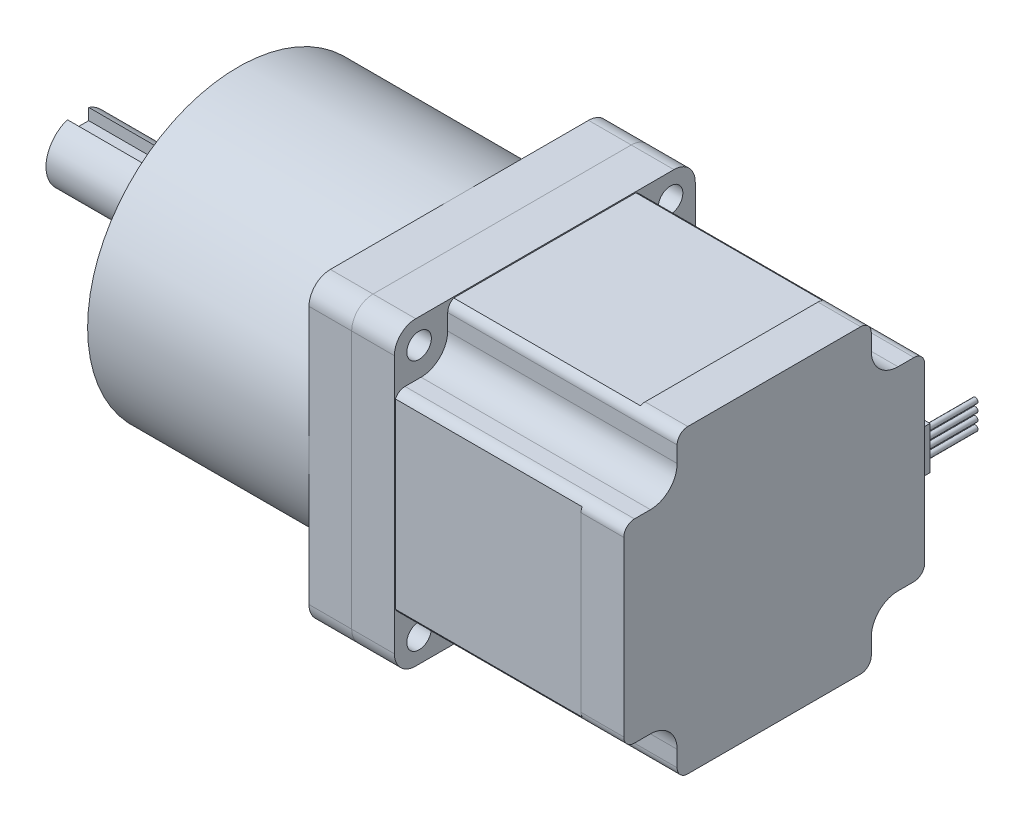
from build123d import *

# Parameters (mm, degrees)
SKETCH_1_W                  = 56.4
SKETCH_1_H                  = 56.4
EXTRUDE_1_DEPTH             = 25.5
SKETCH_7_W                  = 56.4
SKETCH_7_H                  = 56.4
SKETCH_7_W_2                = 56
SKETCH_7_H_2                = 56
CUT_EXTRUDE_1_DEPTH         = 17.5
SKETCH_2_R                  = 19.05
EXTRUDE_2_DEPTH             = 1.6
SKETCH_3_R                  = 3.175
EXTRUDE_3_DEPTH             = 19
SKETCH_10_W                 = 3
SKETCH_10_H                 = 8
EXTRUDE_4_DEPTH             = 3
SKETCH_11_R                 = 0.5
EXTRUDE_5_DEPTH             = 10
SKETCH_12_W                 = 10
SKETCH_12_H                 = 10
CUT_EXTRUDE_2_DEPTH         = 43
FILLET_2_R                  = 5
FILLET_3_R                  = 2
HOLE_WIZARD_4_6_4_6_1_D     = 4.6
HOLE_WIZARD_4_6_4_6_1_DEPTH = 10
HOLE_WIZARD_4_6_4_6_1_TIP   = 1.381979424
FILLET_1_R                  = 4
SKETCH_13_R                 = 2.3
EXTRUDE_6_DEPTH             = 8
SKETCH_14_R                 = 28.2
EXTRUDE_7_DEPTH             = 41.5
SKETCH_15_R                 = 16
EXTRUDE_8_DEPTH             = 2
SKETCH_16_R                 = 6
EXTRUDE_9_DEPTH             = 28
CUT_EXTRUDE_START           = 3.5
CUT_EXTRUDE_4_DEPTH         = 28
HOLE_WIZARD_M5_1_AT_2_COUNT = 2
HOLE_WIZARD_M5_1_AT_2_PITCH = 31.819805153
HOLE_WIZARD_M5_1_AT_3_COUNT = 2
HOLE_WIZARD_M5_1_AT_3_PITCH = 31.819805153
HOLE_WIZARD_M5_1_AT_4_COUNT = 2
HOLE_WIZARD_M5_1_AT_4_PITCH = 45


with BuildPart() as part:
    # 草图1 → 凸台-拉伸1 (new, symmetric)
    with BuildSketch(Plane(origin=(0, 0, 0), x_dir=(0, 0, -1), z_dir=(1, 0, 0))):
        Rectangle(SKETCH_1_W, SKETCH_1_H)
    extrude(amount=EXTRUDE_1_DEPTH, both=True)

    # 草图7 → 切除-拉伸1 (cut, symmetric)
    with BuildSketch(Plane(origin=(0, 0, 0), x_dir=(0, 0, -1), z_dir=(1, 0, 0))):
        Rectangle(SKETCH_7_W, SKETCH_7_H)
        Rectangle(SKETCH_7_W_2, SKETCH_7_H_2, mode=Mode.SUBTRACT)
    extrude(amount=CUT_EXTRUDE_1_DEPTH, both=True, mode=Mode.SUBTRACT)

    # 草图2 → 凸台-拉伸2 (add)
    with BuildSketch(Plane.ZY.offset(25.5)):
        with Locations(Location((0, 0, 0), (0, 0, 180))):
            Circle(SKETCH_2_R)
    extrude(amount=EXTRUDE_2_DEPTH)

    # 草图3 → 凸台-拉伸3 (add)
    with BuildSketch(Plane.ZY.offset(27.1)):
        Circle(SKETCH_3_R)
    extrude(amount=EXTRUDE_3_DEPTH)

    # 草图10 → 凸台-拉伸4 (add)
    with BuildSketch(Plane(origin=(0, 0, -28.2), x_dir=(-1, 0, 0), z_dir=(0, 0, -1))):
        with Locations((-22, 0)):
            Rectangle(SKETCH_10_W, SKETCH_10_H)
    extrude(amount=EXTRUDE_4_DEPTH)

    # 草图11 → 凸台-拉伸5 (add)
    with BuildSketch(Plane(origin=(0, 0, -31.2), x_dir=(-1, 0, 0), z_dir=(0, 0, -1))):
        with Locations(Location((-22, -2.5, 0), (0, 0, 180))):
            Circle(SKETCH_11_R)
        with Locations(Location((-22, -1, 0), (0, 0, 180))):
            Circle(SKETCH_11_R)
        with Locations(Location((-22, 0.5, 0), (0, 0, 180))):
            Circle(SKETCH_11_R)
        with Locations(Location((-22, 2, 0), (0, 0, 180))):
            Circle(SKETCH_11_R)
    extrude(amount=EXTRUDE_5_DEPTH)

    # 草图12 → 切除-拉伸2 (cut)
    with BuildSketch(Plane(origin=(25.5, 0, 0), x_dir=(0, 0, -1), z_dir=(1, 0, 0))):
        with Locations((23.2, -23.2)):
            Rectangle(SKETCH_12_W, SKETCH_12_H)
        with Locations((-23.2, -23.2)):
            Rectangle(SKETCH_12_W, SKETCH_12_H)
        with Locations((-23.2, 23.2)):
            Rectangle(SKETCH_12_W, SKETCH_12_H)
        with Locations((23.2, 23.2)):
            Rectangle(SKETCH_12_W, SKETCH_12_H)
    extrude(amount=-CUT_EXTRUDE_2_DEPTH, mode=Mode.SUBTRACT)

    # 圆角2
    fillet_2_edges = [part.edges().sort_by_distance(p)[0] for p in [
        (4, -18.2, 18.2),
        (4, 18.2, 18.2),
        (4, 18.2, -18.2),
        (4, -18.2, -18.2),
    ]]
    fillet(fillet_2_edges, radius=FILLET_2_R)

    # 圆角3
    fillet_3_edges = [part.edges().sort_by_distance(p)[0] for p in [
        (21.5, 28.2, -18.2),
        (21.5, 28.2, 18.2),
        (21.5, 18.2, 28.2),
        (21.5, -18.2, 28.2),
        (21.5, -28.2, 18.2),
        (21.5, -28.2, -18.2),
        (21.5, -18.2, -28.2),
        (21.5, 18.2, -28.2),
    ]]
    fillet(fillet_3_edges, radius=FILLET_3_R)

    # Ø4.6 (4.6) 直径孔1
    with Locations(Plane.ZY.offset(25.5)):
        with Locations((-23.57, 23.57), (23.57, 23.57), (23.57, -23.57), (-23.57, -23.57)):
            Hole(HOLE_WIZARD_4_6_4_6_1_D / 2, depth=HOLE_WIZARD_4_6_4_6_1_DEPTH)
            with Locations((0, 0, -(HOLE_WIZARD_4_6_4_6_1_DEPTH + HOLE_WIZARD_4_6_4_6_1_TIP / 2))):  # 118° drill point
                Cone(0, HOLE_WIZARD_4_6_4_6_1_D / 2, HOLE_WIZARD_4_6_4_6_1_TIP, mode=Mode.SUBTRACT)

    # 圆角1
    fillet_1_edges = [part.edges().sort_by_distance(p)[0] for p in [
        (-21.5, 28.2, 28.2),
        (-21.5, 28.2, -28.2),
        (-21.5, -28.2, -28.2),
        (-21.5, -28.2, 28.2),
    ]]
    fillet(fillet_1_edges, radius=FILLET_1_R)


with BuildPart() as body_2:
    # 草图13 → 凸台-拉伸6 (new body)
    with BuildSketch(Plane.ZY.offset(25.5)):
        with BuildLine():
            Line((-24.2, -28.2), (24.2, -28.2))
            ThreePointArc((24.2, -28.2), (27.028427125, -27.028427125), (28.2, -24.2))
            Line((28.2, -24.2), (28.2, 24.2))
            ThreePointArc((28.2, 24.2), (27.028427125, 27.028427125), (24.2, 28.2))
            Line((24.2, 28.2), (-24.2, 28.2))
            ThreePointArc((-24.2, 28.2), (-27.028427125, 27.028427125), (-28.2, 24.2))
            Line((-28.2, 24.2), (-28.2, -24.2))
            ThreePointArc((-28.2, -24.2), (-27.028427125, -27.028427125), (-24.2, -28.2))
        make_face()
        with Locations((-23.57, 23.57)):
            Circle(SKETCH_13_R, mode=Mode.SUBTRACT)
        with Locations((23.57, 23.57)):
            Circle(SKETCH_13_R, mode=Mode.SUBTRACT)
        with Locations((-23.57, -23.57)):
            Circle(SKETCH_13_R, mode=Mode.SUBTRACT)
        with Locations((23.57, -23.57)):
            Circle(SKETCH_13_R, mode=Mode.SUBTRACT)
    extrude(amount=EXTRUDE_6_DEPTH)

    # 草图14 → 凸台-拉伸7 (add)
    with BuildSketch(Plane.ZY.offset(33.5)):
        Circle(SKETCH_14_R)
    extrude(amount=EXTRUDE_7_DEPTH)

    # 草图15 → 凸台-拉伸8 (add)
    with BuildSketch(Plane.ZY.offset(75)):
        Circle(SKETCH_15_R)
    extrude(amount=EXTRUDE_8_DEPTH)

    # 草图16 → 凸台-拉伸9 (add)
    with BuildSketch(Plane.ZY.offset(77)):
        Circle(SKETCH_16_R)
    extrude(amount=EXTRUDE_9_DEPTH)

    # 草图17 → 切除-拉伸4 (cut)
    with BuildSketch(Plane(origin=(0, 0, 0), x_dir=(1, 0, 0), z_dir=(0, 1, 0)).offset(CUT_EXTRUDE_START)):
        with BuildLine():
            Line((-105, 2), (-87, 2))
            ThreePointArc((-87, 2), (-85, 0), (-87, -2))
            Line((-87, -2), (-105, -2))
            ThreePointArc((-105, -2), (-107, 0), (-105, 2))
        make_face()
    extrude(amount=CUT_EXTRUDE_4_DEPTH, mode=Mode.SUBTRACT)

    # 草图19 → M5 螺纹孔1 (revolve, cut)
    with BuildSketch(Plane(origin=(-75, 15.909902577, -15.909902577), x_dir=(0, 0, 1), z_dir=(0, 1, 0))):
        Polygon((0, 0), (0, 13.6618073), (2.1, 12.4), (2.1, 0), align=None)
    hole_wizard_m5_1 = revolve(axis=Axis((-81.35, 15.909902577, -15.909902577), (1, 0, 0)), mode=Mode.SUBTRACT)

    # M5 螺纹孔1 at 2: M5 螺纹孔1 ×2
    with Locations(*[(0, 0, i * HOLE_WIZARD_M5_1_AT_2_PITCH) for i in range(1, HOLE_WIZARD_M5_1_AT_2_COUNT)]):
        add(hole_wizard_m5_1, mode=Mode.SUBTRACT)

    # M5 螺纹孔1 at 3: M5 螺纹孔1 ×2
    with Locations(*[(0, -i * HOLE_WIZARD_M5_1_AT_3_PITCH, 0) for i in range(1, HOLE_WIZARD_M5_1_AT_3_COUNT)]):
        add(hole_wizard_m5_1, mode=Mode.SUBTRACT)

    # M5 螺纹孔1 at 4: M5 螺纹孔1 ×2
    with Locations(*[Vector(0, -0.7071067811865475, 0.7071067811865477) * (i * HOLE_WIZARD_M5_1_AT_4_PITCH) for i in range(1, HOLE_WIZARD_M5_1_AT_4_COUNT)]):
        add(hole_wizard_m5_1, mode=Mode.SUBTRACT)


solid = Compound([part.part, body_2.part])
